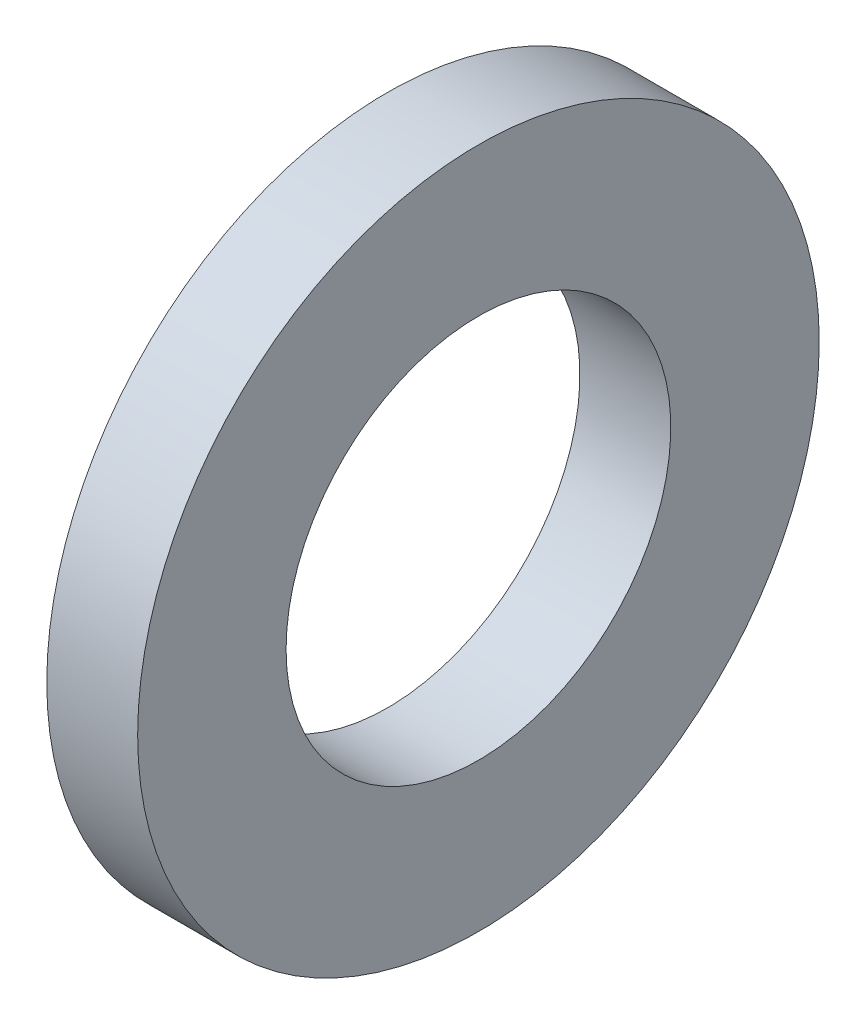
from build123d import *

# Parameters (mm, degrees)
SKETCH1_R           = 5.715
SKETCH1_R_2         = 3.2258
BOSS_EXTRUDE1_DEPTH = 0.762
SKETCH2_R           = 5.715
SKETCH2_R_2         = 3.2258
BOSS_EXTRUDE2_DEPTH = 0.762


with BuildPart() as part:
    # Sketch1 → Boss-Extrude1 (new body)
    with BuildSketch(Plane(origin=(0, 0, 0), x_dir=(0, 0, -1), z_dir=(1, 0, 0))):
        with Locations(Location((0, 0, 0), (0, 0, 180))):
            Circle(SKETCH1_R)
        with Locations(Location((0, 0, 0), (0, 0, 180))):
            Circle(SKETCH1_R_2, mode=Mode.SUBTRACT)
    extrude(amount=BOSS_EXTRUDE1_DEPTH)

    # Sketch2 → Boss-Extrude2 (add)
    with BuildSketch(Plane.ZY.offset(-0.762)):
        Circle(SKETCH2_R)
        Circle(SKETCH2_R_2, mode=Mode.SUBTRACT)
    extrude(amount=-BOSS_EXTRUDE2_DEPTH)


solid = part.part
